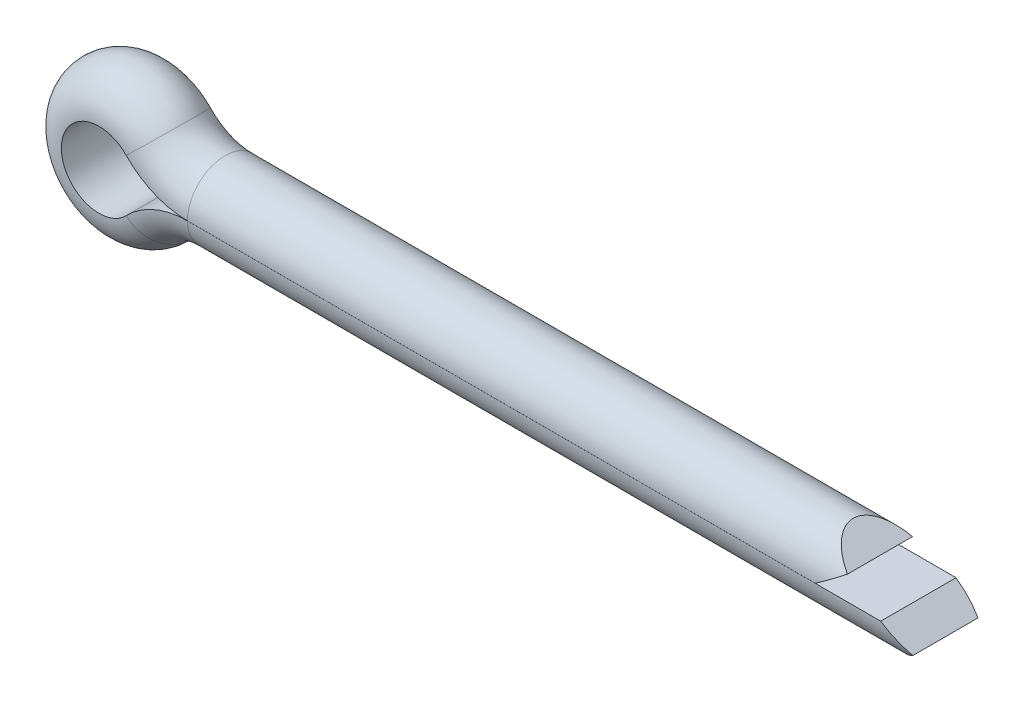
from build123d import *

# Parameters (mm, degrees)
CONECUT_DEPTH      = 45.299548501
CONECUT_DEPTH_BACK = 45.299548501


with BuildPart() as part:
    # Body: sweep along a path in PathSke
    with BuildLine(Plane.XY) as body_path:
        Line((40, 2.3), (0, 2.3))
        ThreePointArc((0, 2.3), (-1.132140619, 2.531061156), (-2.083193033, 3.187285922))
        ThreePointArc((-2.083193033, 3.187285922), (-10, 0), (-2.083193033, -3.187285922))
        ThreePointArc((-2.083193033, -3.187285922), (-1.132140619, -2.531061156), (0, -2.3))
        Line((0, -2.3), (44, -2.3))
    # SectionSke → Body (sweep)
    with BuildSketch(Plane(origin=(40, 0, 0), x_dir=(0, 0, -1), z_dir=(1, 0, 0))):
        with BuildLine():
            Line((-2.29999913, 0.002), (2.29999913, 0.002))
            ThreePointArc((2.29999913, 0.002), (0, 2.3), (-2.29999913, 0.002))
        make_face()
    sweep(path=body_path.line)

    # ConeCutSke → ConeCut (cut, two sides: drawn at the far end of the back side and taken through both)
    with BuildSketch(Plane.XY.offset(-CONECUT_DEPTH_BACK)):
        Polygon((40, 1.151), (38.353289882, 2.31), (44.01, 2.31), (44.01, -2.31), (42.353289882, -2.31), (44, -1.151), (42.347688222, 0), (38.347688222, 0), align=None)
    extrude(amount=CONECUT_DEPTH + CONECUT_DEPTH_BACK, mode=Mode.SUBTRACT)


solid = part.part
